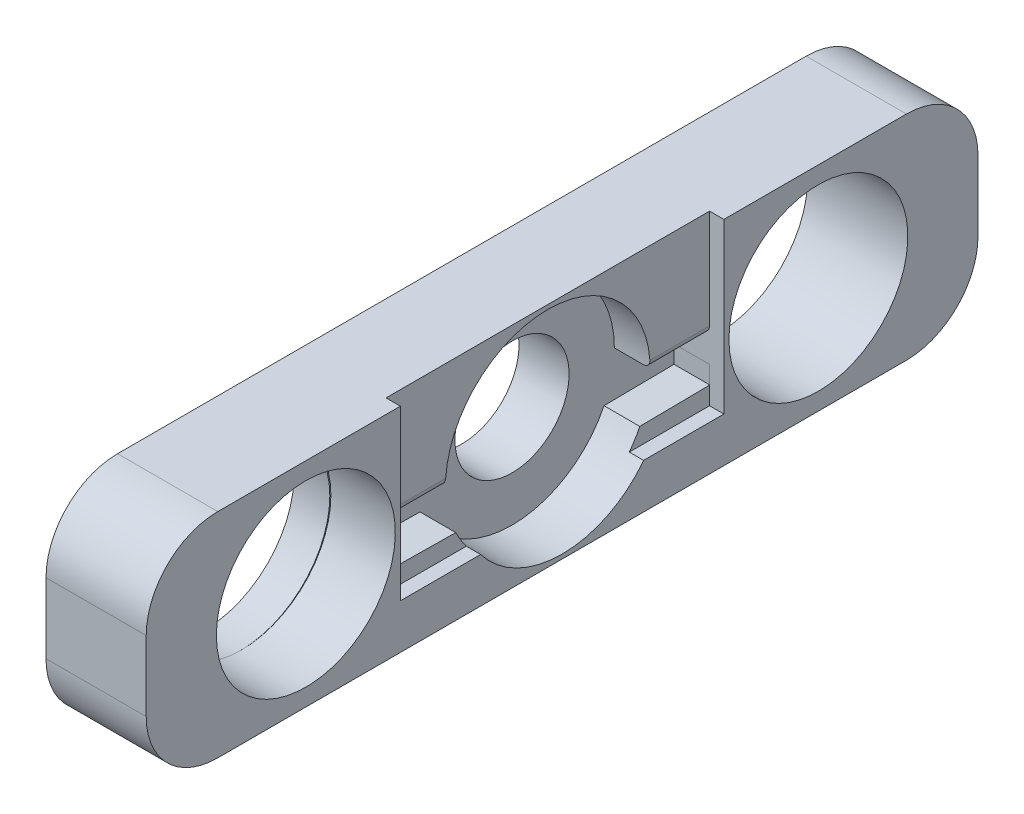
from build123d import *

# Parameters (mm, degrees)
BOSS_EXTRUDE1_START  = -17
BOSS_EXTRUDE1_DEPTH  = 34
SKETCH2_R            = 14.3
CUT_EXTRUDE1_DEPTH   = 32
SKETCH3_R            = 7.975
CUT_EXTRUDE2_DEPTH   = 68.982497748
SKETCH4_R            = 12.5
CUT_EXTRUDE3_DEPTH   = 69.946500999
FILLET5_R            = 10
FILLET6_R            = 10
FILLET5_OF_MIRROR1_R = 10
FILLET6_OF_MIRROR1_R = 10
SKETCH12_W           = 71.004828568
SKETCH12_H           = 128.011080482
CUT_EXTRUDE4_DEPTH   = 25
SKETCH13_W           = 23.55
SKETCH13_H           = 45.2
CUT_EXTRUDE5_DEPTH   = 2
CUT_EXTRUDE6_DEPTH   = 5
SKETCH15_R           = 12.5
SKETCH15_R_2         = 7.975
BOSS_EXTRUDE2_DEPTH  = 5
FILLET7_R            = 1
FILLET8_R            = 1


with BuildPart() as part:
    # Sketch1 → Boss-Extrude1 (new body)
    with BuildSketch(Plane.YZ.offset(BOSS_EXTRUDE1_START)):
        with BuildLine():
            Line((-14.9, 0), (-14.9, 58.1))
            Line((-14.9, 58.1), (14.9, 58.1))
            Line((14.9, 58.1), (14.9, 0))
            ThreePointArc((14.9, 0), (0, -14.9), (-14.9, 0))
        make_face()
    boss_extrude1 = extrude(amount=BOSS_EXTRUDE1_DEPTH)

    # Sketch2 → Cut-Extrude1 (cut)
    with BuildSketch(Plane.YZ.offset(17)):
        with Locations(Location((0, 0, 0), (0, 0, 270))):
            Circle(SKETCH2_R)
    cut_extrude1 = extrude(amount=-CUT_EXTRUDE1_DEPTH, mode=Mode.SUBTRACT)

    # Sketch3 → Cut-Extrude2 (cut, through all)
    with BuildSketch(Plane.YZ.offset(-15)):
        with Locations(Location((0, 0, 0), (0, 0, 270))):
            Circle(SKETCH3_R)
    cut_extrude2 = extrude(amount=-CUT_EXTRUDE2_DEPTH, mode=Mode.SUBTRACT)

    # Sketch4 → Cut-Extrude3 (cut, through all)
    with BuildSketch(Plane.YZ.offset(17)):
        with Locations(Location((0, 35.8, 0), (0, 0, 270))):
            Circle(SKETCH4_R)
    cut_extrude3 = extrude(amount=-CUT_EXTRUDE3_DEPTH, mode=Mode.SUBTRACT)

    # Fillet5
    fillet5_edges = [part.edges().sort_by_distance(p)[0] for p in [
        (0, 14.9, 58.1),
    ]]
    fillet(fillet5_edges, radius=FILLET5_R)

    # Fillet6
    fillet6_edges = [part.edges().sort_by_distance(p)[0] for p in [
        (0, -14.9, 58.1),
    ]]
    fillet(fillet6_edges, radius=FILLET6_R)

    # Mirror1: Boss-Extrude1, Cut-Extrude1, Cut-Extrude2, Cut-Extrude3 across plane
    add(boss_extrude1.mirror(Plane.XY))
    add(cut_extrude1.mirror(Plane.XY), mode=Mode.SUBTRACT)
    add(cut_extrude2.mirror(Plane.XY), mode=Mode.SUBTRACT)
    add(cut_extrude3.mirror(Plane.XY), mode=Mode.SUBTRACT)

    # Fillet5 of Mirror1
    fillet5_of_mirror1_edges = [part.edges().sort_by_distance(p)[0] for p in [
        (0, 14.9, -58.1),
    ]]
    fillet(fillet5_of_mirror1_edges, radius=FILLET5_OF_MIRROR1_R)

    # Fillet6 of Mirror1
    fillet6_of_mirror1_edges = [part.edges().sort_by_distance(p)[0] for p in [
        (0, -14.9, -58.1),
    ]]
    fillet(fillet6_of_mirror1_edges, radius=FILLET6_OF_MIRROR1_R)

    # Sketch12 → Cut-Extrude4 (cut)
    with BuildSketch(Plane.YZ.offset(17)):
        Rectangle(SKETCH12_W, SKETCH12_H)
    extrude(amount=-CUT_EXTRUDE4_DEPTH, mode=Mode.SUBTRACT)

    # Sketch13 → Cut-Extrude5 (cut)
    with BuildSketch(Plane.YZ.offset(-8)):
        with Locations((3.125, 0)):
            Rectangle(SKETCH13_W, SKETCH13_H)
    extrude(amount=-CUT_EXTRUDE5_DEPTH, mode=Mode.SUBTRACT)

    # Sketch14 → Cut-Extrude6 (cut)
    with BuildSketch(Plane.YZ.offset(-10)):
        with BuildLine():
            Line((-6.1496227, -22.630710053), (-3.65, -22.6))
            Line((-3.65, -22.6), (0, -22.6))
            Line((0, -22.6), (0, -14.3))
            ThreePointArc((0, -14.3), (-1.840302956, -14.181088993), (-3.65, -13.82633357))
            ThreePointArc((-3.65, -13.82633357), (-4.983735764, -13.403446491), (-6.269759745, -12.852241545))
            Line((-6.269759745, -12.852241545), (-6.1496227, -22.630710053))
        make_face()
    cut_extrude6 = extrude(amount=-CUT_EXTRUDE6_DEPTH, mode=Mode.SUBTRACT)

    # Mirror2: Cut-Extrude6 across plane
    add(cut_extrude6.mirror(Plane.XY), mode=Mode.SUBTRACT)

    # Sketch15 → Boss-Extrude2 (add)
    with BuildSketch(Plane(origin=(-17, 0, 0), x_dir=(0, -1, 0), z_dir=(-1, 0, 0))):
        with BuildLine():
            Line((-4.9, -58.1), (4.9, -58.1))
            ThreePointArc((4.9, -58.1), (11.971067812, -55.171067812), (14.9, -48.1))
            Line((14.9, -48.1), (14.9, 48.1))
            ThreePointArc((14.9, 48.1), (11.971067812, 55.171067812), (4.9, 58.1))
            Line((4.9, 58.1), (-4.9, 58.1))
            ThreePointArc((-4.9, 58.1), (-11.971067812, 55.171067812), (-14.9, 48.1))
            Line((-14.9, 48.1), (-14.9, -48.1))
            ThreePointArc((-14.9, -48.1), (-11.971067812, -55.171067812), (-4.9, -58.1))
        make_face()
        with Locations(Location((0, 35.95, 0), (0, 0, 180.34377674))):
            Circle(SKETCH15_R, mode=Mode.SUBTRACT)
        with Locations(Location((0, 0, 0), (0, 0, 90))):
            Circle(SKETCH15_R_2, mode=Mode.SUBTRACT)
        with Locations(Location((0, -35.8, 0), (0, 0, 90))):
            Circle(SKETCH15_R, mode=Mode.SUBTRACT)
    extrude(amount=BOSS_EXTRUDE2_DEPTH)

    # Fillet7
    fillet7_edges = [part.edges().sort_by_distance(p)[0] for p in [
        (-10, 0, -18.45),
    ]]
    fillet(fillet7_edges, radius=FILLET7_R)

    # Fillet8
    fillet8_edges = [part.edges().sort_by_distance(p)[0] for p in [
        (-10, 0, 18.45),
    ]]
    fillet(fillet8_edges, radius=FILLET8_R)


solid = part.part
